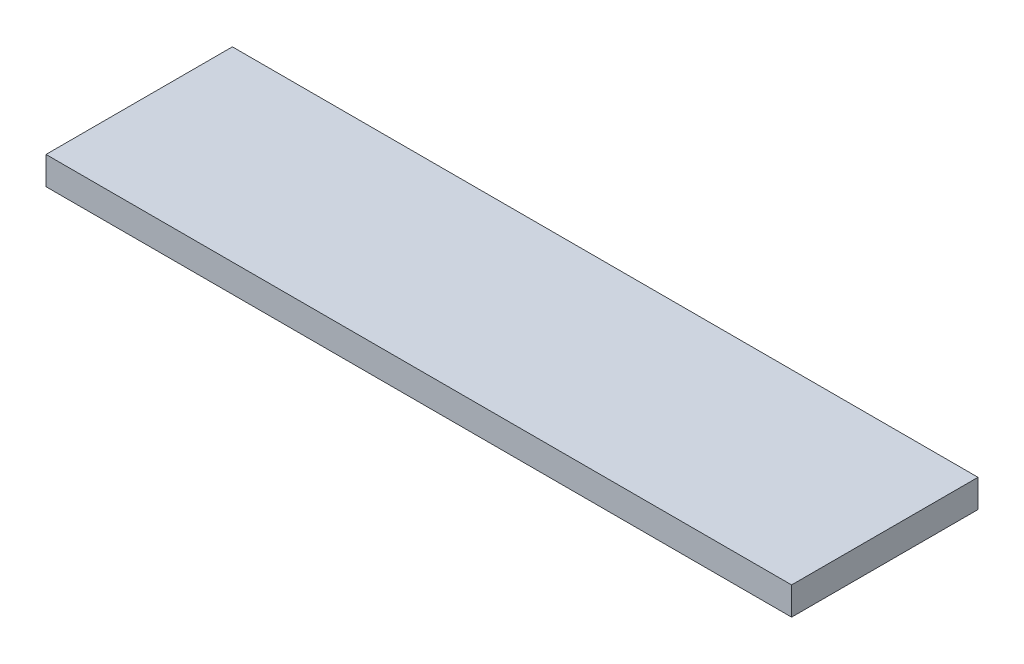
from build123d import *

# Parameters (mm, degrees)
ESQUISSE1_W        = 400
ESQUISSE1_H        = 100
BOSS_EXTRU_1_DEPTH = 15


with BuildPart() as part:
    # Esquisse1 → Boss.-Extru.1 (new body)
    with BuildSketch(Plane(origin=(0, 0, 0), x_dir=(1, 0, 0), z_dir=(0, 1, 0))):
        Rectangle(ESQUISSE1_W, ESQUISSE1_H)
    extrude(amount=BOSS_EXTRU_1_DEPTH)


solid = part.part
